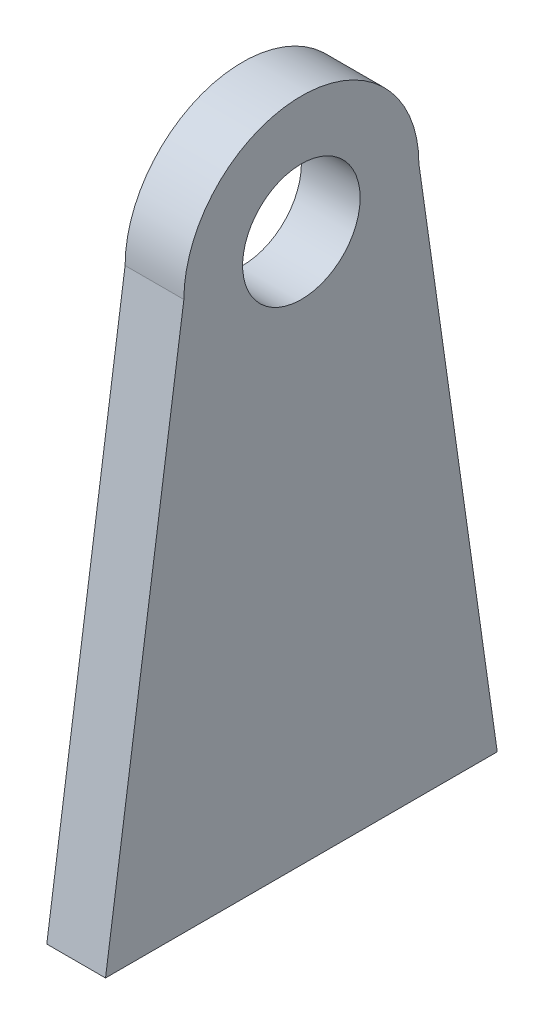
from build123d import *

# Parameters (mm, degrees)
SKETCH1_R           = 6
BOSS_EXTRUDE1_DEPTH = 6


with BuildPart() as part:
    # Sketch1 → Boss-Extrude1 (new body)
    with BuildSketch(Plane(origin=(0, 0, 0), x_dir=(0, 0, -1), z_dir=(1, 0, 0))):
        with BuildLine():
            Line((0, 0), (40, 0))
            Line((40, 0), (32, 56))
            ThreePointArc((32, 56), (20, 68), (8, 56))
            Line((8, 56), (0, 0))
        make_face()
        with Locations((20, 56)):
            Circle(SKETCH1_R, mode=Mode.SUBTRACT)
    extrude(amount=BOSS_EXTRUDE1_DEPTH)


solid = part.part
